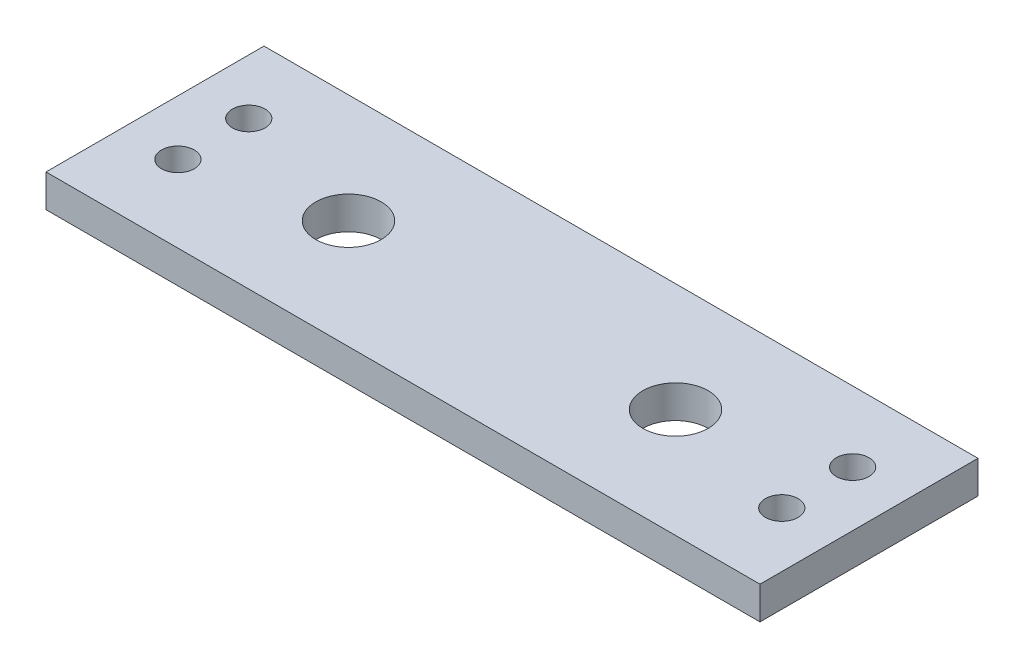
from build123d import *

# Parameters (mm, degrees)
SKETCH1_W           = 65.5
SKETCH1_H           = 20
BOSS_EXTRUDE1_DEPTH = 3
SKETCH2_R           = 1.501708332
SKETCH2_R_2         = 1.501220282
SKETCH2_R_3         = 1.5
SKETCH2_R_4         = 3
CUT_EXTRUDE1_DEPTH  = 3


with BuildPart() as part:
    # Sketch1 → Boss-Extrude1 (new body)
    with BuildSketch(Plane(origin=(0, 0, 0), x_dir=(1, 0, 0), z_dir=(0, 1, 0))):
        with Locations((32.75, 10)):
            Rectangle(SKETCH1_W, SKETCH1_H)
    extrude(amount=BOSS_EXTRUDE1_DEPTH)

    # Sketch2 → Cut-Extrude1 (cut)
    with BuildSketch(Plane(origin=(0, 3, 0), x_dir=(1, 0, 0), z_dir=(0, 1, 0))):
        with Locations(Location((60.45, 13.55, 0), (0, 0, 270))):
            Circle(SKETCH2_R)
        with Locations(Location((60.45, 7.05, 0), (0, 0, 270))):
            Circle(SKETCH2_R_2)
        with Locations(Location((5.05, 13.55, 0), (0, 0, 270))):
            Circle(SKETCH2_R_3)
        with Locations(Location((5.05, 7.05, 0), (0, 0, 270))):
            Circle(SKETCH2_R_3)
        with Locations(Location((47.75, 10, 0), (0, 0, 270))):
            Circle(SKETCH2_R_4)
        with Locations(Location((17.75, 10, 0), (0, 0, 270))):
            Circle(SKETCH2_R_4)
    extrude(amount=-CUT_EXTRUDE1_DEPTH, mode=Mode.SUBTRACT)


solid = part.part
